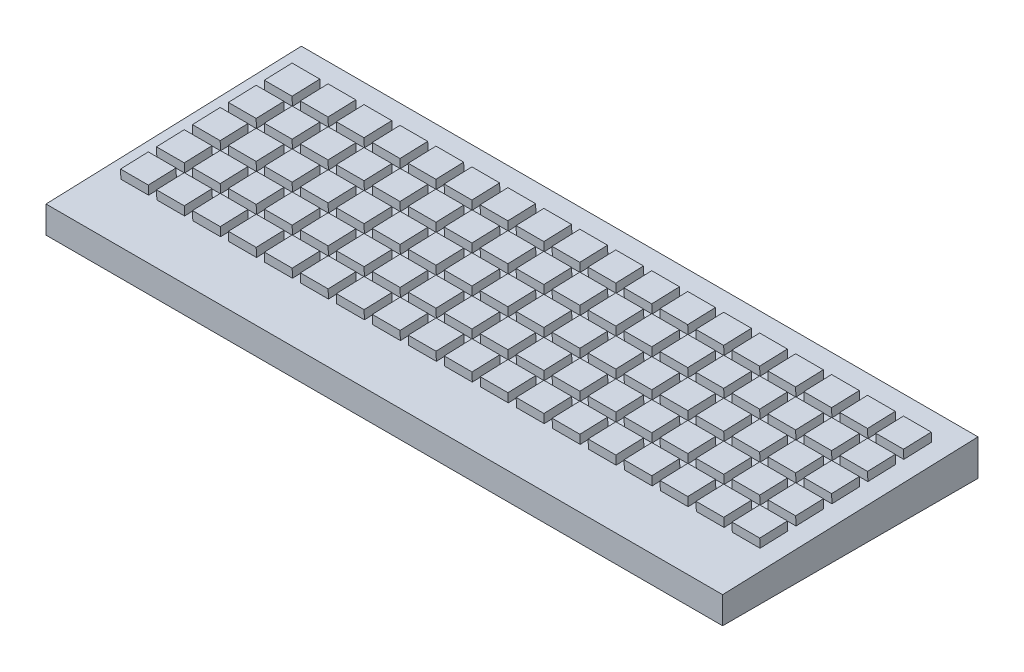
from build123d import *

# Parameters (mm, degrees)
BOSS_EXTRUDE1_DEPTH  = 188.1375
SKETCH2_W            = 15.433069799
SKETCH2_H            = 15.433069799
BOSS_EXTRUDE2_DEPTH  = 5
LPATTERN1_COUNT      = 18
LPATTERN1_PITCH      = 20
LPATTERN1_COUNT_DIR2 = 5
LPATTERN1_PITCH_DIR2 = 20
CUT_EXTRUDE1_DEPTH   = 12
LPATTERN2_COUNT      = 34
LPATTERN2_PITCH      = 10
CUT_EXTRUDE2_DEPTH   = 12


with BuildPart() as part:
    # Sketch1 → Boss-Extrude1 (new, symmetric)
    with BuildSketch(Plane(origin=(0, 0, 0), x_dir=(0, 0, -1), z_dir=(1, 0, 0))):
        Polygon((-142, 0), (0, 0), (0, 20), (-142, 15), align=None)
    extrude(amount=BOSS_EXTRUDE1_DEPTH, both=True)

    # Sketch3 → Cut-Extrude1 (cut)
    with BuildSketch(Plane.XZ):
        Polygon((-172.582229546, 119.311498443), (-164.365937835, 135.531577218), (-159.00019631, 135.531577218), (-167.216488021, 119.311498443), align=None)
    cut_extrude1 = extrude(amount=-CUT_EXTRUDE1_DEPTH, mode=Mode.SUBTRACT)

    # LPattern2: Cut-Extrude1 ×34
    with Locations(*[(i * LPATTERN2_PITCH, 0, 0) for i in range(1, LPATTERN2_COUNT)]):
        add(cut_extrude1, mode=Mode.SUBTRACT)

    # Sketch5 → Cut-Extrude2 (cut)
    with BuildSketch(Plane.XZ):
        Polygon((-169.00019631, 135.531577218), (-177.216488021, 119.311498443), (-178.1375, 119.311498443), (-178.1375, 128.085999873), (-174.365937835, 135.531577218), align=None)
        Polygon((166.956084769, 119.311498443), (175.634062165, 135.531577218), (177.080998216, 135.531577218), (177.080998216, 128.206905744), (172.321826294, 119.311498443), align=None)
    extrude(amount=-CUT_EXTRUDE2_DEPTH, mode=Mode.SUBTRACT)


with BuildPart() as body_2:
    # Sketch2 → Boss-Extrude2 (new, symmetric)
    with BuildSketch(Plane(origin=(0, 19.975234038, 0.703353311), x_dir=(1, 0, 0), z_dir=(0, 0.9993806591669091, 0.03518945982982076))):
        with Locations((-170.420965101, -22.012745703)):
            Rectangle(SKETCH2_W, SKETCH2_H)
    boss_extrude2 = extrude(amount=BOSS_EXTRUDE2_DEPTH, both=True)


with BuildPart() as lpattern1_1:
    # LPattern1: Boss-Extrude2 18 × 5
    with Locations(*[Vector(1, 0, 0) * (i * LPATTERN1_PITCH) + Vector(0, -0.03518945982982079, 0.999380659166909) * (j * LPATTERN1_PITCH_DIR2) for i in range(LPATTERN1_COUNT) for j in range(LPATTERN1_COUNT_DIR2) if (i, j) != (0, 0)]):
        add(boss_extrude2)


solid = Compound([part.part, body_2.part, lpattern1_1.part])
